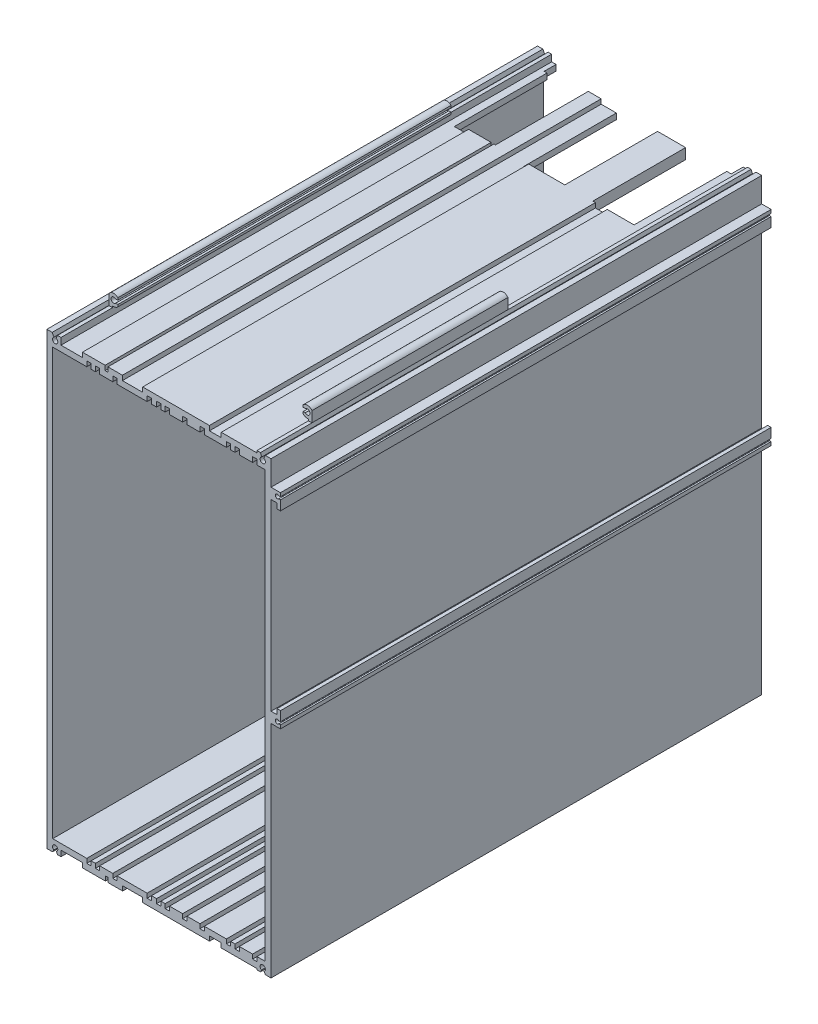
from build123d import *

# Parameters (mm, degrees)
BOSS_EXTRUDE1_DEPTH = 278
BOSS_EXTRUDE2_DEPTH = 188.8
CUT_EXTRUDE3_REACH  = 407.15
SKETCH4_W           = 77.8
SKETCH4_H           = 20.823727225
CUT_EXTRUDE4_REACH  = 403.136
SKETCH5_W           = 106
SKETCH5_H           = 6.75
CUT_EXTRUDE5_REACH  = 403.136
SKETCH6_W           = 23.35
SKETCH6_H           = 52.55


with BuildPart() as part:
    # Sketch2 → Boss-Extrude1 (new body)
    with BuildSketch(Plane.XY):
        with BuildLine():
            Line((14.499999531, 257.585773296), (14.499999531, 261.373383253))
            Line((14.499999531, 261.373383253), (12.499999531, 261.373383253))
            Line((12.499999531, 261.373383253), (11.766447114, 259.574707108))
            ThreePointArc((11.766447114, 259.574707108), (12.4449235, 259.022531512), (12.699999531, 258.185773296))
            ThreePointArc((12.699999531, 258.185773296), (10.428246686, 256.899539434), (10.494136136, 259.509312818))
            Line((10.494136136, 259.509312818), (9.499999531, 261.373383253))
            Line((9.499999531, 261.373383253), (6.499999531, 261.373383253))
            Line((6.499999531, 261.373383253), (6.499999531, 6.573383253))
            Line((6.499999531, 6.573383253), (9.699999531, 6.573383253))
            Line((9.699999531, 6.573383253), (10.453087922, 7.884956995))
            ThreePointArc((10.453087922, 7.884956995), (10.448456922, 10.483919553), (12.699999531, 9.185773296))
            ThreePointArc((12.699999531, 9.185773296), (12.47478685, 8.395256191), (11.866776475, 7.842118389))
            Line((11.866776475, 7.842118389), (12.496375142, 6.573383253))
            Line((12.496375142, 6.573383253), (14.496375142, 6.573383253))
            Line((14.496375142, 6.573383253), (14.496375142, 9.785773296))
            Line((14.496375142, 9.785773296), (26.596375142, 9.785773296))
            Line((26.596375142, 9.785773296), (26.596375142, 7.202035453))
            Line((26.596375142, 7.202035453), (39.696375142, 7.202035453))
            Line((39.696375142, 7.202035453), (39.696375142, 9.785773296))
            Line((39.696375142, 9.785773296), (41.199999531, 9.785773296))
            Line((41.199999531, 9.785773296), (41.199999531, 7.202035453))
            Line((41.199999531, 7.202035453), (49.449999531, 7.202035453))
            Line((49.449999531, 7.202035453), (49.449999531, 9.785773296))
            Line((49.449999531, 9.785773296), (60.549999531, 9.785773296))
            Line((60.549999531, 9.785773296), (60.549999531, 7.202035453))
            Line((60.549999531, 7.202035453), (98.649999531, 7.202035453))
            Line((98.649999531, 7.202035453), (98.649999531, 9.785773296))
            Line((98.649999531, 9.785773296), (105.249999531, 9.785773296))
            Line((105.249999531, 9.785773296), (105.249999531, 7.202035453))
            Line((105.249999531, 7.202035453), (125.499999531, 7.202035453))
            Line((125.499999531, 7.202035453), (125.499999531, 6.573383253))
            Line((125.499999531, 6.573383253), (127.499999531, 6.573383253))
            Line((127.499999531, 6.573383253), (128.131728013, 7.842861095))
            ThreePointArc((128.131728013, 7.842861095), (128.010191731, 10.461000193), (130.299999531, 9.185773296))
            ThreePointArc((130.299999531, 9.185773296), (130.098145789, 8.434230687), (129.54691114, 7.884956995))
            Line((129.54691114, 7.884956995), (130.299999531, 6.573383253))
            Line((130.299999531, 6.573383253), (133.499999531, 6.573383253))
            Line((133.499999531, 6.573383253), (133.499999531, 131.473383253))
            Line((133.499999531, 131.473383253), (138.849999531, 131.473383253))
            Line((138.849999531, 131.473383253), (138.849999531, 133.473383253))
            Line((138.849999531, 133.473383253), (137.935232058, 133.473383253))
            ThreePointArc((137.935232058, 133.473383253), (135.950499999, 134.164830282), (137.890474853, 134.973383253))
            Line((137.890474853, 134.973383253), (138.849999531, 134.973383253))
            Line((138.849999531, 134.973383253), (138.849999531, 140.423383253))
            Line((138.849999531, 140.423383253), (136.899999531, 140.423383253))
            Line((136.899999531, 140.423383253), (136.899999531, 137.473383253))
            Line((136.899999531, 137.473383253), (133.499999531, 137.473383253))
            Line((133.499999531, 137.473383253), (133.499999531, 241.373383253))
            Line((133.499999531, 241.373383253), (136.899999531, 241.373383253))
            Line((136.899999531, 241.373383253), (136.899999531, 238.423383253))
            Line((136.899999531, 238.423383253), (138.849999531, 238.423383253))
            Line((138.849999531, 238.423383253), (138.849999531, 243.873383253))
            Line((138.849999531, 243.873383253), (137.890474853, 243.873383253))
            ThreePointArc((137.890474853, 243.873383253), (135.950499999, 244.681936224), (137.935232058, 245.373383253))
            Line((137.935232058, 245.373383253), (138.849999531, 245.373383253))
            Line((138.849999531, 245.373383253), (138.849999531, 247.373383253))
            Line((138.849999531, 247.373383253), (133.499999531, 247.373383253))
            Line((133.499999531, 247.373383253), (133.499999531, 261.373383253))
            Line((133.499999531, 261.373383253), (130.299999531, 261.373383253))
            Line((130.299999531, 261.373383253), (129.438677048, 259.543009837))
            ThreePointArc((129.438677048, 259.543009837), (130.06649396, 258.989509485), (130.299999531, 258.185773296))
            ThreePointArc((130.299999531, 258.185773296), (127.963241315, 256.940849327), (128.233551948, 259.574707108))
            Line((128.233551948, 259.574707108), (127.499999531, 261.373383253))
            Line((127.499999531, 261.373383253), (125.499999531, 261.373383253))
            Line((125.499999531, 261.373383253), (125.499999531, 260.239968056))
            Line((125.499999531, 260.239968056), (105.299999531, 260.239968056))
            Line((105.299999531, 260.239968056), (105.299999531, 257.585773296))
            Line((105.299999531, 257.585773296), (98.599999531, 257.585773296))
            Line((98.599999531, 257.585773296), (98.599999531, 260.239968056))
            Line((98.599999531, 260.239968056), (60.799999531, 260.239968056))
            Line((60.799999531, 260.239968056), (60.799999531, 257.585773296))
            Line((60.799999531, 257.585773296), (49.299999531, 257.585773296))
            Line((49.299999531, 257.585773296), (49.299999531, 260.239968056))
            Line((49.299999531, 260.239968056), (41.099999531, 260.239968056))
            Line((41.099999531, 260.239968056), (41.099999531, 257.585773296))
            Line((41.099999531, 257.585773296), (39.499999531, 257.585773296))
            Line((39.499999531, 257.585773296), (39.499999531, 260.239968056))
            Line((39.499999531, 260.239968056), (26.699999531, 260.239968056))
            Line((26.699999531, 260.239968056), (26.699999531, 257.585773296))
            Line((26.699999531, 257.585773296), (14.499999531, 257.585773296))
        make_face()
        Polygon((9.799999531, 13.085773296), (9.799999531, 254.285773296), (29.099999531, 254.285773296), (29.099999531, 257.185773296), (31.549999531, 257.185773296), (31.549999531, 254.285773296), (33.999999531, 254.285773296), (33.999999531, 257.185773296), (36.449999531, 257.185773296), (36.449999531, 254.285773296), (43.849999531, 254.285773296), (43.849999531, 257.185773296), (46.299999531, 257.185773296), (46.299999531, 254.285773296), (63.299999531, 254.285773296), (63.299999531, 257.185773296), (65.749999531, 257.185773296), (65.749999531, 254.285773296), (68.649999531, 254.285773296), (68.649999531, 257.185773296), (71.099999531, 257.185773296), (71.099999531, 254.285773296), (73.549999531, 254.285773296), (73.549999531, 257.185773296), (75.999999531, 257.185773296), (75.999999531, 254.285773296), (83.399999531, 254.285773296), (83.399999531, 257.185773296), (85.849999531, 257.185773296), (85.849999531, 254.285773296), (93.249999531, 254.285773296), (93.249999531, 257.185773296), (95.699999531, 257.185773296), (95.699999531, 254.285773296), (108.199999531, 254.285773296), (108.199999531, 257.185773296), (110.649999531, 257.185773296), (110.649999531, 254.285773296), (113.099999531, 254.285773296), (113.099999531, 257.185773296), (115.549999531, 257.185773296), (115.549999531, 254.285773296), (123.049999531, 254.285773296), (123.049999531, 257.185773296), (125.499999531, 257.185773296), (125.499999531, 254.285773296), (130.199999531, 254.285773296), (130.199999531, 13.085773296), (125.499999531, 13.085773296), (125.499999531, 10.605647121), (123.049999531, 10.605647121), (123.049999531, 13.085773296), (115.549999531, 13.085773296), (115.549999531, 10.605647121), (113.099999531, 10.605647121), (113.099999531, 13.085773296), (110.649999531, 13.085773296), (110.649999531, 10.605647121), (108.199999531, 10.605647121), (108.199999531, 13.085773296), (95.699999531, 13.085773296), (95.699999531, 10.605647121), (93.249999531, 10.605647121), (93.249999531, 13.085773296), (85.849999531, 13.085773296), (85.849999531, 10.605647121), (83.399999531, 10.605647121), (83.399999531, 13.085773296), (75.999999531, 13.085773296), (75.999999531, 10.605647121), (73.549999531, 10.605647121), (73.549999531, 13.085773296), (71.099999531, 13.085773296), (71.099999531, 10.605647121), (68.649999531, 10.605647121), (68.649999531, 13.085773296), (65.749999531, 13.085773296), (65.749999531, 10.605647121), (63.299999531, 10.605647121), (63.299999531, 13.085773296), (46.299999531, 13.085773296), (46.299999531, 10.605647121), (43.849999531, 10.605647121), (43.849999531, 13.085773296), (36.449999531, 13.085773296), (36.449999531, 10.605647121), (33.999999531, 10.605647121), (33.999999531, 13.085773296), (31.549999531, 13.085773296), (31.549999531, 10.605647121), (29.099999531, 10.605647121), (29.099999531, 13.085773296), align=None, mode=Mode.SUBTRACT)
    extrude(amount=BOSS_EXTRUDE1_DEPTH)

    # Sketch3 → Boss-Extrude2 (add)
    with BuildSketch(Plane(origin=(0, 0, 60), x_dir=(-1, 0, 0), z_dir=(0, 0, -1))):
        with BuildLine():
            ThreePointArc((-17.499999531, 263.24640733), (-16.121371693, 262.388956123), (-14.499999531, 262.30535229))
            Line((-14.499999531, 262.30535229), (-14.499999531, 264.027871507))
            ThreePointArc((-14.499999531, 264.027871507), (-15.443429897, 263.94278526), (-16.249723759, 264.439968056))
            Line((-16.249723759, 264.439968056), (-17.499999531, 264.439968056))
            Line((-17.499999531, 264.439968056), (-17.499999531, 263.24640733))
        make_face()
        with BuildLine():
            Line((-14.499999531, 264.027871507), (-14.499999531, 262.30535229))
            ThreePointArc((-14.499999531, 262.30535229), (-13.376269152, 262.765773779), (-12.499999531, 263.606552859))
            Line((-12.499999531, 263.606552859), (-12.499999531, 267.373383253))
            ThreePointArc((-12.499999531, 267.373383253), (-13.376269152, 268.214162333), (-14.499999531, 268.674583822))
            Line((-14.499999531, 268.674583822), (-14.499999531, 266.777802835))
            ThreePointArc((-14.499999531, 266.777802835), (-13.844699353, 266.224622869), (-13.59955722, 265.402837171))
            ThreePointArc((-13.59955722, 265.402837171), (-13.844699353, 264.581051473), (-14.499999531, 264.027871507))
        make_face()
        with BuildLine():
            Line((-14.499999531, 262.30535229), (-14.499999531, 261.373383253))
            Line((-14.499999531, 261.373383253), (-12.499999531, 261.373383253))
            Line((-12.499999531, 261.373383253), (-12.499999531, 263.606552859))
            ThreePointArc((-12.499999531, 263.606552859), (-13.376269152, 262.765773779), (-14.499999531, 262.30535229))
        make_face()
        with BuildLine():
            ThreePointArc((-16.077786922, 266.539968056), (-15.323140468, 266.886080418), (-14.499999531, 266.777802835))
            Line((-14.499999531, 266.777802835), (-14.499999531, 268.674583822))
            ThreePointArc((-14.499999531, 268.674583822), (-16.121371693, 268.590979989), (-17.499999531, 267.733528783))
            Line((-17.499999531, 267.733528783), (-17.499999531, 266.539968056))
            Line((-17.499999531, 266.539968056), (-16.077786922, 266.539968056))
        make_face()
        with BuildLine():
            Line((-127.499999531, 263.606552859), (-127.499999531, 261.373383253))
            Line((-127.499999531, 261.373383253), (-125.499999531, 261.373383253))
            Line((-125.499999531, 261.373383253), (-125.499999531, 262.30535229))
            ThreePointArc((-125.499999531, 262.30535229), (-126.62372991, 262.765773779), (-127.499999531, 263.606552859))
        make_face()
        with BuildLine():
            Line((-127.499999531, 267.373383253), (-127.499999531, 263.606552859))
            ThreePointArc((-127.499999531, 263.606552859), (-126.62372991, 262.765773779), (-125.499999531, 262.30535229))
            Line((-125.499999531, 262.30535229), (-125.499999531, 264.027871507))
            ThreePointArc((-125.499999531, 264.027871507), (-126.400441842, 265.402837171), (-125.499999531, 266.777802835))
            Line((-125.499999531, 266.777802835), (-125.499999531, 268.674583822))
            ThreePointArc((-125.499999531, 268.674583822), (-126.62372991, 268.214162333), (-127.499999531, 267.373383253))
        make_face()
        with BuildLine():
            ThreePointArc((-122.499999531, 267.733528783), (-123.878627369, 268.590979989), (-125.499999531, 268.674583822))
            Line((-125.499999531, 268.674583822), (-125.499999531, 266.777802835))
            ThreePointArc((-125.499999531, 266.777802835), (-124.676858594, 266.886080418), (-123.922212141, 266.539968056))
            Line((-123.922212141, 266.539968056), (-122.499999531, 266.539968056))
            Line((-122.499999531, 266.539968056), (-122.499999531, 267.733528783))
        make_face()
        with BuildLine():
            Line((-125.499999531, 264.027871507), (-125.499999531, 262.30535229))
            ThreePointArc((-125.499999531, 262.30535229), (-123.878627369, 262.388956123), (-122.499999531, 263.24640733))
            Line((-122.499999531, 263.24640733), (-122.499999531, 264.439968056))
            Line((-122.499999531, 264.439968056), (-123.750275303, 264.439968056))
            ThreePointArc((-123.750275303, 264.439968056), (-124.556569165, 263.94278526), (-125.499999531, 264.027871507))
        make_face()
    extrude(amount=-BOSS_EXTRUDE2_DEPTH)

    # Sketch4 → Cut-Extrude3 (cut, up to next)
    with BuildSketch(Plane(origin=(127.499999531, 0, 0), x_dir=(0, 0, -1), z_dir=(1, 0, 0)), mode=Mode.PRIVATE) as cut_extrude3_sk1:
        with Locations((-98.9, 271.785246866)):
            Rectangle(SKETCH4_W, SKETCH4_H)
    cut_extrude3_tool1 = extrude(cut_extrude3_sk1.sketch, amount=-CUT_EXTRUDE3_REACH, mode=Mode.PRIVATE) & part.part
    add(cut_extrude3_tool1.solids().sort_by_distance((127.5, 271.785247, 98.9))[0], mode=Mode.SUBTRACT)

    # Sketch5 → Cut-Extrude4 (cut, up to next)
    with BuildSketch(Plane(origin=(0, 260.239968056, 0), x_dir=(1, 0, 0), z_dir=(0, 1, 0)), mode=Mode.PRIVATE) as cut_extrude4_sk1:
        with Locations((69.999999531, -3.375)):
            Rectangle(SKETCH5_W, SKETCH5_H)
    cut_extrude4_tool1 = extrude(cut_extrude4_sk1.sketch, amount=-CUT_EXTRUDE4_REACH, mode=Mode.PRIVATE) & part.part
    add(cut_extrude4_tool1.solids().sort_by_distance((70, 260.239968, 3.375))[0], mode=Mode.SUBTRACT)

    # Sketch6 → Cut-Extrude5 (cut, up to next)
    with BuildSketch(Plane(origin=(0, 260.239968056, 0), x_dir=(1, 0, 0), z_dir=(0, 1, 0)), mode=Mode.PRIVATE) as cut_extrude5_sk1:
        with Locations((108.824999531, -33.025)):
            Rectangle(SKETCH6_W, SKETCH6_H)
    cut_extrude5_tool1 = extrude(cut_extrude5_sk1.sketch, amount=-CUT_EXTRUDE5_REACH, mode=Mode.PRIVATE) & part.part
    # Sketch6 → Cut-Extrude5 (cut, up to next)
    with BuildSketch(Plane(origin=(0, 260.239968056, 0), x_dir=(1, 0, 0), z_dir=(0, 1, 0)), mode=Mode.PRIVATE) as cut_extrude5_sk2:
        with Locations((69.574999531, -33.025)):
            Rectangle(SKETCH6_W, SKETCH6_H)
    cut_extrude5_tool2 = extrude(cut_extrude5_sk2.sketch, amount=-CUT_EXTRUDE5_REACH, mode=Mode.PRIVATE) & part.part
    # Sketch6 → Cut-Extrude5 (cut, up to next)
    with BuildSketch(Plane(origin=(0, 260.239968056, 0), x_dir=(1, 0, 0), z_dir=(0, 1, 0)), mode=Mode.PRIVATE) as cut_extrude5_sk3:
        with Locations((30.324999531, -33.025)):
            Rectangle(SKETCH6_W, SKETCH6_H)
    cut_extrude5_tool3 = extrude(cut_extrude5_sk3.sketch, amount=-CUT_EXTRUDE5_REACH, mode=Mode.PRIVATE) & part.part
    add(cut_extrude5_tool1.solids().sort_by_distance((108.825, 260.239968, 33.025))[0], mode=Mode.SUBTRACT)
    add(cut_extrude5_tool2.solids().sort_by_distance((69.575, 260.239968, 33.025))[0], mode=Mode.SUBTRACT)
    add(cut_extrude5_tool3.solids().sort_by_distance((30.325, 260.239968, 33.025))[0], mode=Mode.SUBTRACT)


solid = part.part
